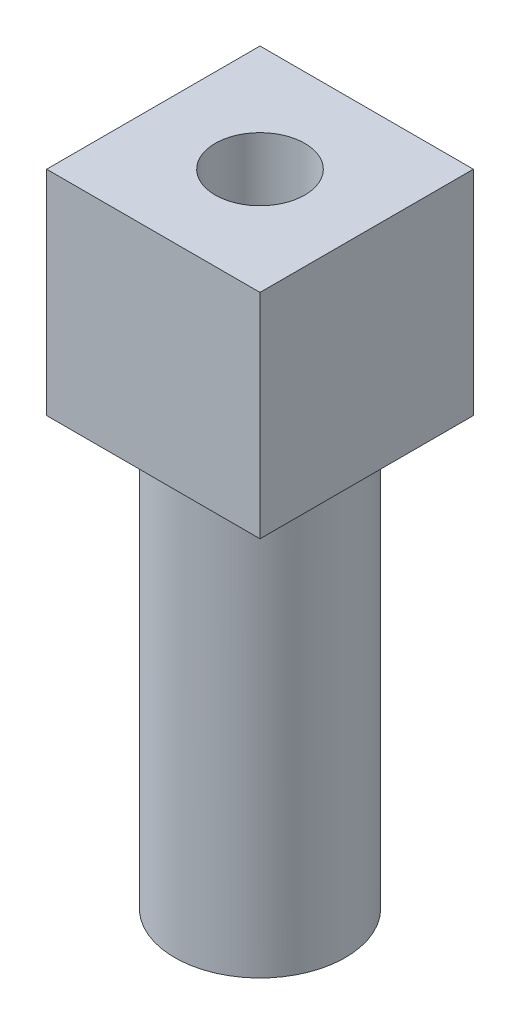
from build123d import *

# Parameters (mm, degrees)
SKIZZE1_W                       = 4
SKIZZE1_H                       = 20
SKIZZE5_W                       = 10
SKIZZE5_H                       = 10
AUFSATZ_LINEAR_AUSTRAGEN1_DEPTH = 10
M5_GEWINDEBOHRUNG2_D            = 4.2


with BuildPart() as part:
    # Skizze1 → Rotation1 (revolve)
    with BuildSketch(Plane.XY, mode=Mode.PRIVATE) as rotation1_sk:
        with Locations((2, 10)):
            Rectangle(SKIZZE1_W, SKIZZE1_H)
    revolve(rotation1_sk.sketch.rotate(Axis((0, -2.459302686, 0), (0, 1, 0)), 90), axis=Axis((0, -2.459302686, 0), (0, 1, 0)))

    # Skizze5 → Aufsatz-Linear austragen1 (add)
    with BuildSketch(Plane(origin=(0, 20, 0), x_dir=(1, 0, 0), z_dir=(0, 1, 0))):
        Rectangle(SKIZZE5_W, SKIZZE5_H)
    extrude(amount=AUFSATZ_LINEAR_AUSTRAGEN1_DEPTH)

    # M5 Gewindebohrung2 (through all)
    with Locations(Plane(origin=(0, 30, 0), x_dir=(1, 0, 0), z_dir=(0, 1, 0))):
        with Locations((0, 0)):
            Hole(M5_GEWINDEBOHRUNG2_D / 2)


solid = part.part
